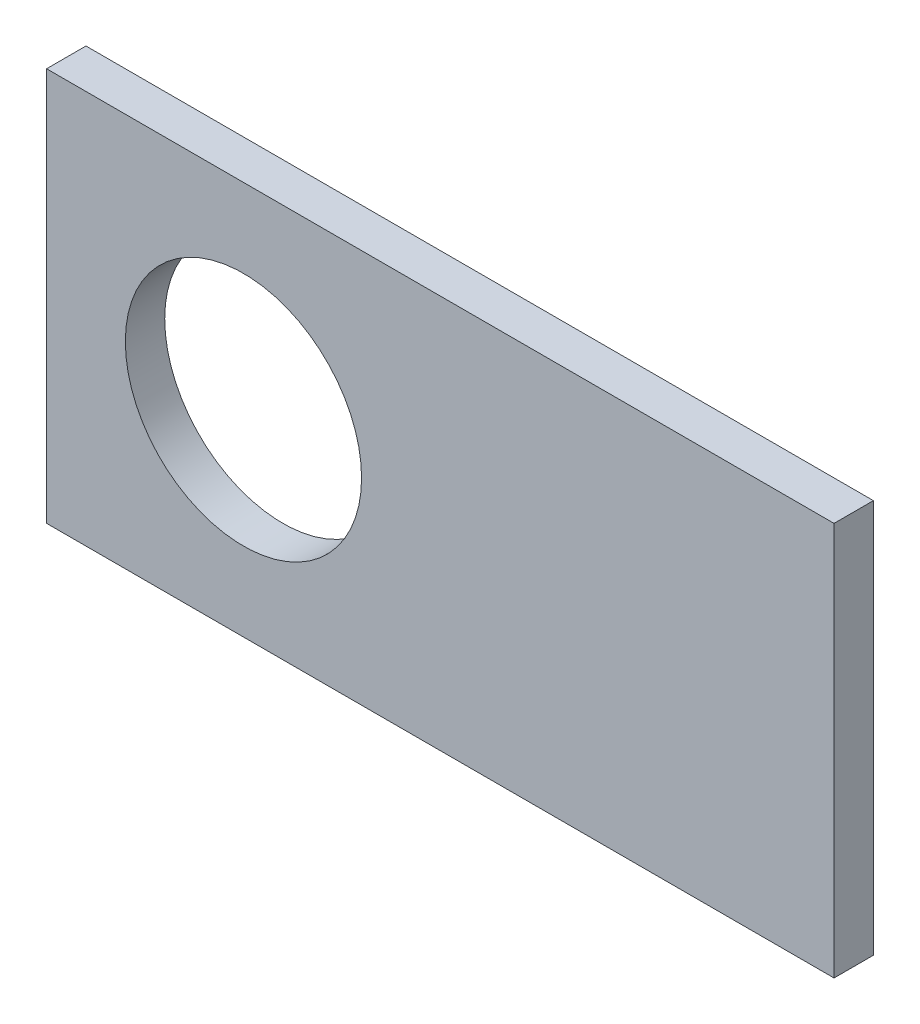
from build123d import *

# Parameters (mm, degrees)
SKETCH_1_R      = 30
EXTRUDE_1_DEPTH = 10


with BuildPart() as part:
    # 草图1 → 凸台-拉伸1 (new body)
    with BuildSketch(Plane.XY):
        Polygon((-50, -50), (50, -50), (150, -50), (150, 50), (50, 50), (-50, 50), align=None)
        Circle(SKETCH_1_R, mode=Mode.SUBTRACT)
    extrude(amount=EXTRUDE_1_DEPTH)


solid = part.part
